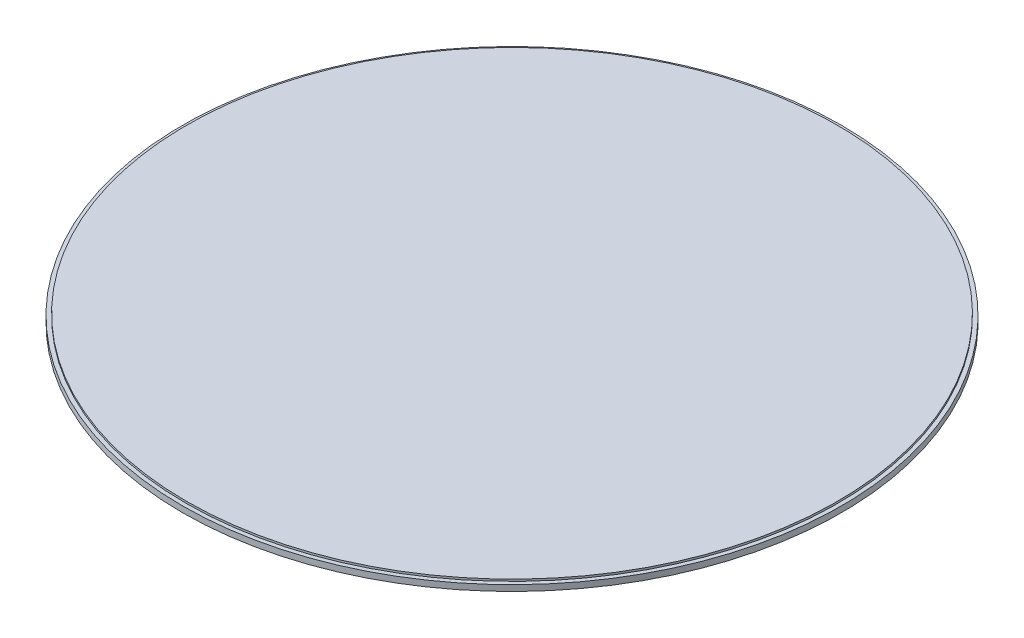
from build123d import *

# Parameters (mm, degrees)
SKETCH1_R           = 42.55
BOSS_EXTRUDE1_DEPTH = 1
SKETCH2_R           = 42.55
SKETCH2_R_2         = 41.55
CUT_EXTRUDE1_DEPTH  = 102.547405362
SKETCH3_R           = 41.55
SKETCH3_R_2         = 41.05
CUT_EXTRUDE2_DEPTH  = 0.25


with BuildPart() as part:
    # Sketch1 → Boss-Extrude1 (new body)
    with BuildSketch(Plane(origin=(0, 0, 0), x_dir=(1, 0, 0), z_dir=(0, 1, 0))):
        with Locations(Location((-46.303063169, -6.602911423, 0), (0, 0, 270))):
            Circle(SKETCH1_R)
    extrude(amount=BOSS_EXTRUDE1_DEPTH)

    # Sketch2 → Cut-Extrude1 (cut, through all)
    with BuildSketch(Plane(origin=(0, 1, 0), x_dir=(1, 0, 0), z_dir=(0, 1, 0))):
        with Locations((-46.303063169, -6.602911423)):
            Circle(SKETCH2_R)
        with Locations(Location((-46.303063169, -6.602911423, 0), (0, 0, 270))):
            Circle(SKETCH2_R_2, mode=Mode.SUBTRACT)
    extrude(amount=-CUT_EXTRUDE1_DEPTH, mode=Mode.SUBTRACT)

    # Sketch3 → Cut-Extrude2 (cut)
    with BuildSketch(Plane(origin=(0, 1, 0), x_dir=(1, 0, 0), z_dir=(0, 1, 0))):
        with Locations(Location((-46.303063169, -6.602911423, 0), (0, 0, 270))):
            Circle(SKETCH3_R)
        with Locations(Location((-46.303063169, -6.602911423, 0), (0, 0, 270))):
            Circle(SKETCH3_R_2, mode=Mode.SUBTRACT)
    extrude(amount=-CUT_EXTRUDE2_DEPTH, mode=Mode.SUBTRACT)


solid = part.part
